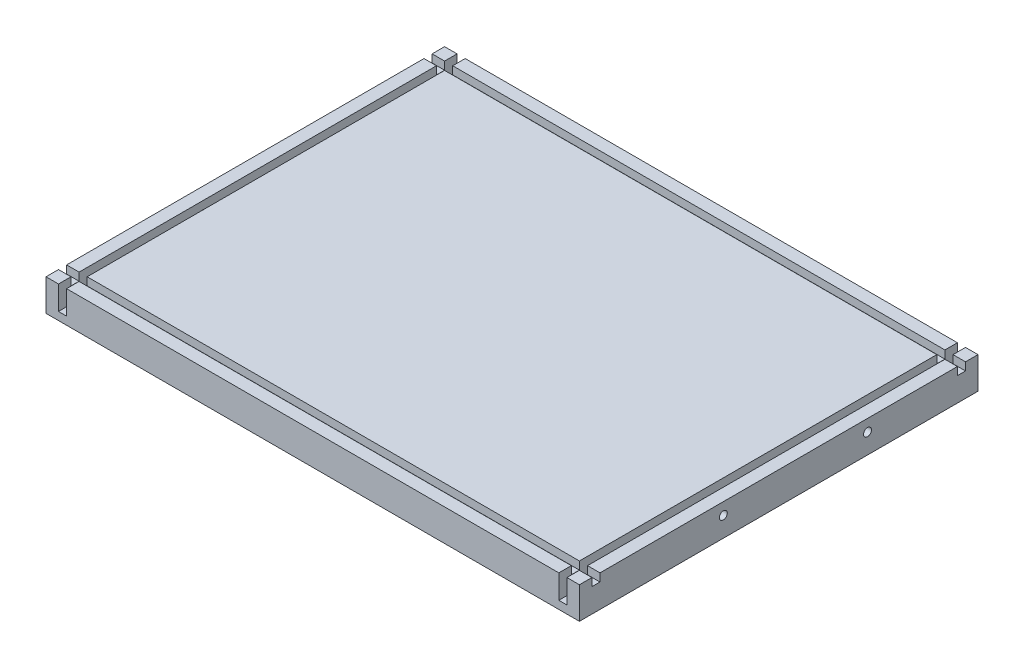
from build123d import *

# Parameters (mm, degrees)
SKETCH1_W           = 427.3
SKETCH1_H           = 319.3
BOSS_EXTRUDE1_DEPTH = 25.4
CUT_EXTRUDE1_DEPTH  = 19.05
SKETCH6_W           = 427.3
SKETCH6_H           = 6.5
CUT_EXTRUDE4_DEPTH  = 6.35
SKETCH4_R           = 3.175
CUT_EXTRUDE2_DEPTH  = 38.1
CUT_EXTRUDE3_START  = -38.1
SKETCH5_R           = 3.175
CUT_EXTRUDE3_DEPTH  = 38.1


with BuildPart() as part:
    # Sketch1 → Boss-Extrude1 (new body)
    with BuildSketch(Plane(origin=(0, 0, 0), x_dir=(1, 0, 0), z_dir=(0, 1, 0))):
        with Locations((213.65, 159.65)):
            Rectangle(SKETCH1_W, SKETCH1_H)
    extrude(amount=BOSS_EXTRUDE1_DEPTH)

    # Sketch2 → Cut-Extrude1 (cut)
    with BuildSketch(Plane(origin=(0, 25.4, 0), x_dir=(1, 0, 0), z_dir=(0, 1, 0))):
        Polygon((410.8, 302.8), (410.8, 16.5), (410.8, 10), (410.8, 0), (417.3, 0), (417.3, 10), (417.3, 16.5), (417.3, 302.8), (417.3, 309.3), (417.3, 319.3), (410.8, 319.3), (410.8, 309.3), align=None)
        Polygon((16.5, 16.5), (16.5, 302.8), (16.5, 309.3), (16.5, 319.3), (10, 319.3), (10, 309.3), (10, 302.8), (10, 16.5), (10, 10), (10, 0), (16.5, 0), (16.5, 10), align=None)
    extrude(amount=-CUT_EXTRUDE1_DEPTH, mode=Mode.SUBTRACT)

    # Sketch6 → Cut-Extrude4 (cut)
    with BuildSketch(Plane(origin=(0, 25.4, 0), x_dir=(1, 0, 0), z_dir=(0, 1, 0))):
        with Locations((213.65, 13.25)):
            Rectangle(SKETCH6_W, SKETCH6_H)
        with Locations((213.65, 306.05)):
            Rectangle(SKETCH6_W, SKETCH6_H)
    extrude(amount=-CUT_EXTRUDE4_DEPTH, mode=Mode.SUBTRACT)

    # Sketch4 → Cut-Extrude2 (cut)
    with BuildSketch(Plane(origin=(427.3, 0, 0), x_dir=(0, 0, -1), z_dir=(1, 0, 0))):
        with Locations((115.275, 15.875)):
            Circle(SKETCH4_R)
        with Locations((230.775, 15.875)):
            Circle(SKETCH4_R)
    extrude(amount=-CUT_EXTRUDE2_DEPTH, mode=Mode.SUBTRACT)

    # Sketch5 → Cut-Extrude3 (cut)
    with BuildSketch(Plane.ZY.offset(CUT_EXTRUDE3_START)):
        with Locations(Location((-230.775, 15.875, 0), (0, 0, 180))):
            Circle(SKETCH5_R)
        with Locations(Location((-115.275, 15.875, 0), (0, 0, 180))):
            Circle(SKETCH5_R)
    extrude(amount=CUT_EXTRUDE3_DEPTH, mode=Mode.SUBTRACT)


solid = part.part
